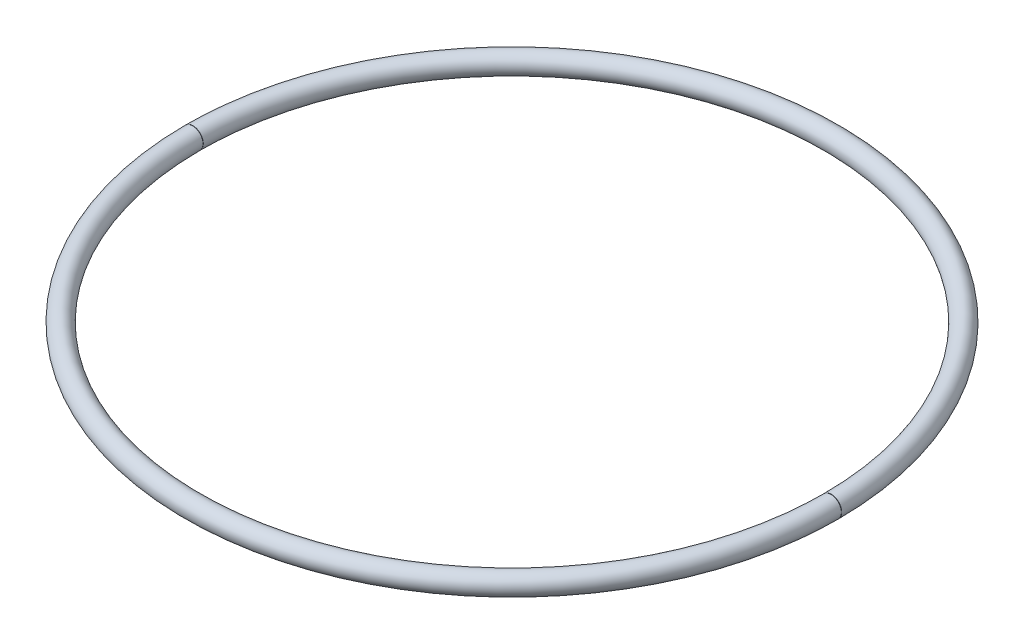
from build123d import *

# Parameters (mm, degrees)
SWEEP2_PROFILE_R        = 25.4
SHELL1_T                = -3.175
CUT_EXTRUDE1_DEPTH      = 1146.264354452
CUT_EXTRUDE1_DEPTH_BACK = 1146.264354452
SKETCH25_W              = 101.6
SKETCH25_H              = 0.732692402


with BuildPart() as part:
    # Sweep2: sweep along a path in Sketch24
    with BuildLine(Plane(origin=(0, 0, 0), x_dir=(1, 0, 0), z_dir=(0, 1, 0))) as sweep2_path:
        ThreePointArc((784.224899576, 0.396875), (-784.225, 0), (784.224899576, -0.396875))
    # Sweep2 profile (on start of the path) → Sweep2 (sweep)
    with BuildSketch(Plane(origin=(784.224899576, 0, -0.396875), x_dir=(-0.9999998719451145, 0, 0.0005060728747702501), z_dir=(-0.0005060728747702501, 0, -0.9999998719451145))):
        Circle(SWEEP2_PROFILE_R)
    sweep(path=sweep2_path.line)

    # Shell1
    shell1_openings = [part.faces().sort_by_distance(p)[0] for p in [
        (784.224899576, 0, 0.396875),
        (784.224899576, 0, -0.396875),
    ]]
    offset(amount=SHELL1_T, openings=shell1_openings, kind=Kind.INTERSECTION)

    # Sketch25 → Cut-Extrude1 (cut, two sides: drawn at the far end of the back side and taken through both)
    with BuildSketch(Plane(origin=(0, 0, 0), x_dir=(1, 0, 0), z_dir=(0, 1, 0)).offset(-CUT_EXTRUDE1_DEPTH_BACK)):
        with Locations((-774.7, 0)):
            Rectangle(SKETCH25_W, SKETCH25_H)
    extrude(amount=CUT_EXTRUDE1_DEPTH + CUT_EXTRUDE1_DEPTH_BACK, mode=Mode.SUBTRACT)


with BuildPart() as cut_extrude1_piece_1:
    # of the separate pieces the step leaves, piece 1, a body of its own (cut_extrude1_pieces)
    add(part.part.solids().sort_by_distance((-758.824911568, 0, 0.366346201))[0])


with BuildPart() as cut_extrude1_piece_2:
    # of the separate pieces the step leaves, piece 2, a body of its own (cut_extrude1_pieces)
    add(part.part.solids().sort_by_distance((758.824902829, 0, -0.384020749))[0])


solid = Compound([cut_extrude1_piece_1.part, cut_extrude1_piece_2.part])
